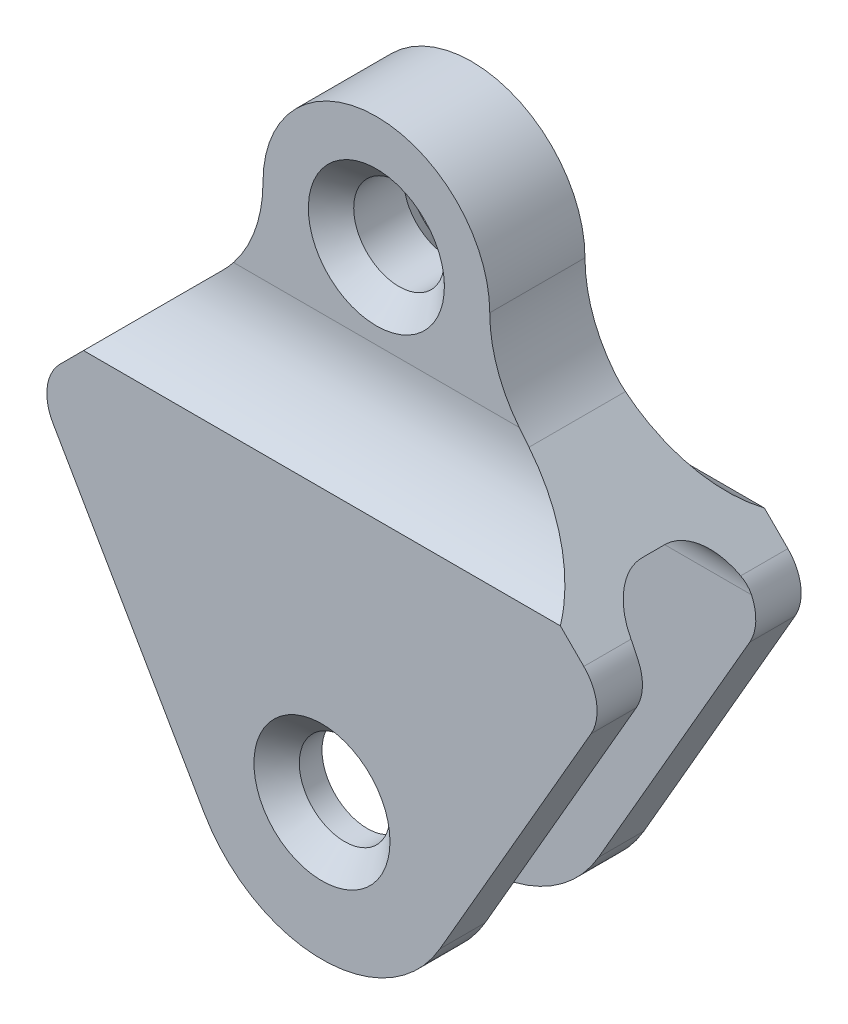
from build123d import *

# Parameters (mm, degrees)
SKETCH1_R               = 10
BOSS_EXTRUDE1_DEPTH     = 22.5
CUT_EXTRUDE1_DEPTH      = 141.755212167
CUT_EXTRUDE1_DEPTH_BACK = 141.755212167
CHAMFER1_SIZE           = 5


with BuildPart() as part:
    # Sketch1 → Boss-Extrude1 (new, symmetric)
    with BuildSketch(Plane.XY):
        with BuildLine():
            Line((-57.740497942, 54.833095187), (-33.786796564, 78.786796564))
            ThreePointArc((-33.786796564, 78.786796564), (-27.283614025, 88.519497029), (-25, 100))
            ThreePointArc((-25, 100), (0, 125), (25, 100))
            ThreePointArc((25, 100), (27.283614025, 88.519497029), (33.786796564, 78.786796564))
            Line((33.786796564, 78.786796564), (57.740497942, 54.833095187))
            ThreePointArc((57.740497942, 54.833095187), (60.583878744, 49.067289298), (59.329684168, 42.762027375))
            Line((59.329684168, 42.762027375), (25.980762114, -15))
            ThreePointArc((25.980762114, -15), (0, -30), (-25.980762114, -15))
            Line((-25.980762114, -15), (-59.329684168, 42.762027375))
            ThreePointArc((-59.329684168, 42.762027375), (-60.583878744, 49.067289298), (-57.740497942, 54.833095187))
        make_face()
        with Locations(Location((0, 100, 0), (0, 0, 180))):
            Circle(SKETCH1_R, mode=Mode.SUBTRACT)
        with Locations(Location((0, 0, 0), (0, 0, 180))):
            Circle(SKETCH1_R, mode=Mode.SUBTRACT)
    extrude(amount=BOSS_EXTRUDE1_DEPTH, both=True)

    # Sketch2 → Cut-Extrude1 (cut, two sides: drawn at the far end of the back side and taken through both)
    with BuildSketch(Plane(origin=(0, 0, 0), x_dir=(0, 0, -1), z_dir=(1, 0, 0)).offset(-CUT_EXTRUDE1_DEPTH_BACK)):
        with BuildLine():
            ThreePointArc((-10.5, 81.354156504), (-13.705505282, 69.10670779), (-22.5, 60))
            Line((-22.5, 60), (-22.5, 125))
            Line((-22.5, 125), (-10.5, 125))
            Line((-10.5, 125), (-10.5, 81.354156504))
        make_face()
        with BuildLine():
            Line((-12.5, 52), (-12.5, -30))
            Line((-12.5, -30), (12.5, -30))
            Line((12.5, -30), (12.5, 52))
            ThreePointArc((12.5, 52), (9.571067812, 59.071067812), (2.5, 62))
            Line((2.5, 62), (-2.5, 62))
            ThreePointArc((-2.5, 62), (-9.571067812, 59.071067812), (-12.5, 52))
        make_face()
        with BuildLine():
            Line((22.5, 60), (22.5, 125))
            Line((22.5, 125), (10.5, 125))
            Line((10.5, 125), (10.5, 81.354156504))
            ThreePointArc((10.5, 81.354156504), (13.705505282, 69.10670779), (22.5, 60))
        make_face()
    extrude(amount=CUT_EXTRUDE1_DEPTH + CUT_EXTRUDE1_DEPTH_BACK, mode=Mode.SUBTRACT)

    # Chamfer1
    chamfer1_edges = [part.edges().sort_by_distance(p)[0] for p in [
        (10, 100, 10.5),
        (10, 0, -22.5),
        (10, 0, 22.5),
        (10, 100, -10.5),
    ]]
    chamfer(chamfer1_edges, length=CHAMFER1_SIZE)


solid = part.part
